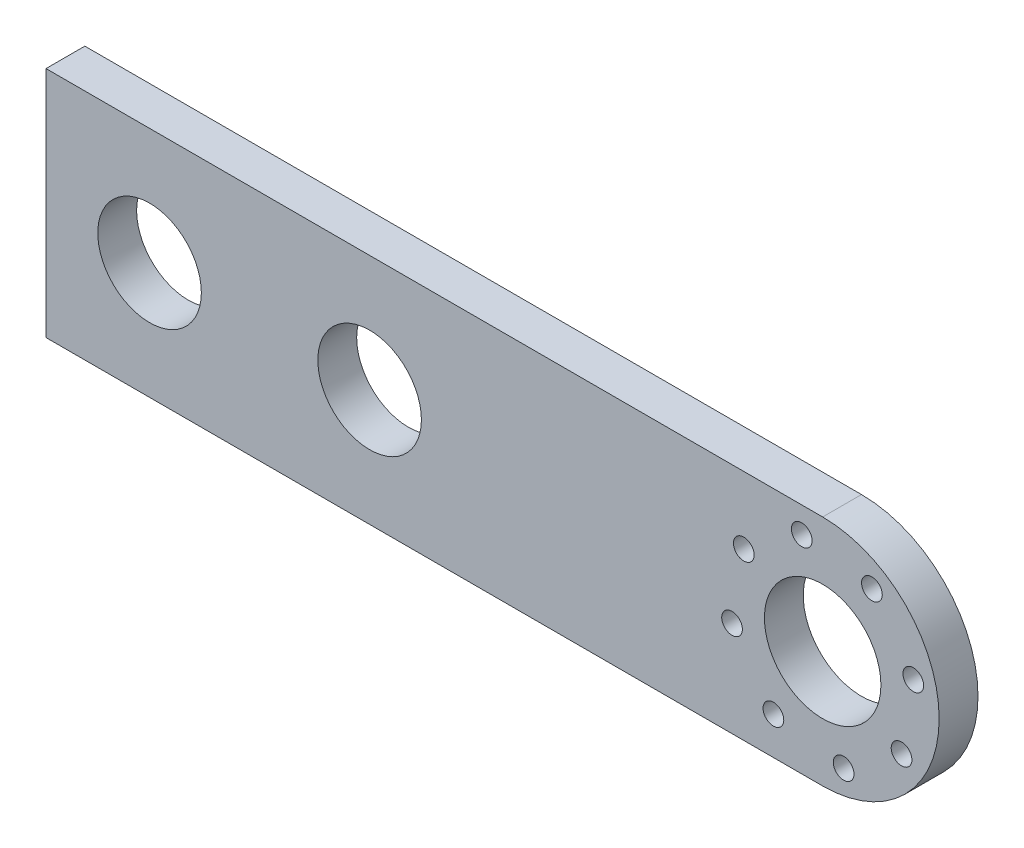
from build123d import *

# Parameters (mm, degrees)
ESQUISSE1_R             = 4.5
ESQUISSE1_R_2           = 0.8
BOSS_EXTRU_1_DEPTH      = 3
ESQUISSE2_R             = 4
ENL_V_MAT_EXTRU_1_DEPTH = 10


with BuildPart() as part:
    # Esquisse1 → Boss.-Extru.1 (new body)
    with BuildSketch(Plane.XY):
        with BuildLine():
            Line((1.597834667, 9), (24.597834667, 9))
            ThreePointArc((24.597834667, 9), (33.597834667, 0), (24.597834667, -9))
            Line((24.597834667, -9), (-35.402165333, -9))
            Line((-35.402165333, -9), (-35.402165333, 9))
            Line((-35.402165333, 9), (-16.752165333, 9))
            Line((-16.752165333, 9), (-7.052165333, 9))
            Line((-7.052165333, 9), (1.597834667, 9))
        make_face()
        with Locations((24.597834667, 0)):
            Circle(ESQUISSE1_R, mode=Mode.SUBTRACT)
        with Locations((22.97907079, 7)):
            Circle(ESQUISSE1_R_2, mode=Mode.SUBTRACT)
        with Locations((28.402943221, 6.094386383)):
            Circle(ESQUISSE1_R_2, mode=Mode.SUBTRACT)
        with Locations((31.597834667, 1.618763877)):
            Circle(ESQUISSE1_R_2, mode=Mode.SUBTRACT)
        with Locations((30.69222105, -3.805108554)):
            Circle(ESQUISSE1_R_2, mode=Mode.SUBTRACT)
        with Locations((26.216598544, -7)):
            Circle(ESQUISSE1_R_2, mode=Mode.SUBTRACT)
        with Locations((20.792726113, -6.094386383)):
            Circle(ESQUISSE1_R_2, mode=Mode.SUBTRACT)
        with Locations((17.597834667, -1.618763877)):
            Circle(ESQUISSE1_R_2, mode=Mode.SUBTRACT)
        with Locations((18.503448284, 3.805108554)):
            Circle(ESQUISSE1_R_2, mode=Mode.SUBTRACT)
    extrude(amount=BOSS_EXTRU_1_DEPTH)

    # Esquisse2 → Enlèv. mat.-Extru.1 (cut)
    with BuildSketch(Plane.XY.offset(3)):
        with Locations((-27.402165333, 0)):
            Circle(ESQUISSE2_R)
        with Locations((-10.402165333, 0)):
            Circle(ESQUISSE2_R)
    extrude(amount=-ENL_V_MAT_EXTRU_1_DEPTH, mode=Mode.SUBTRACT)


solid = part.part
